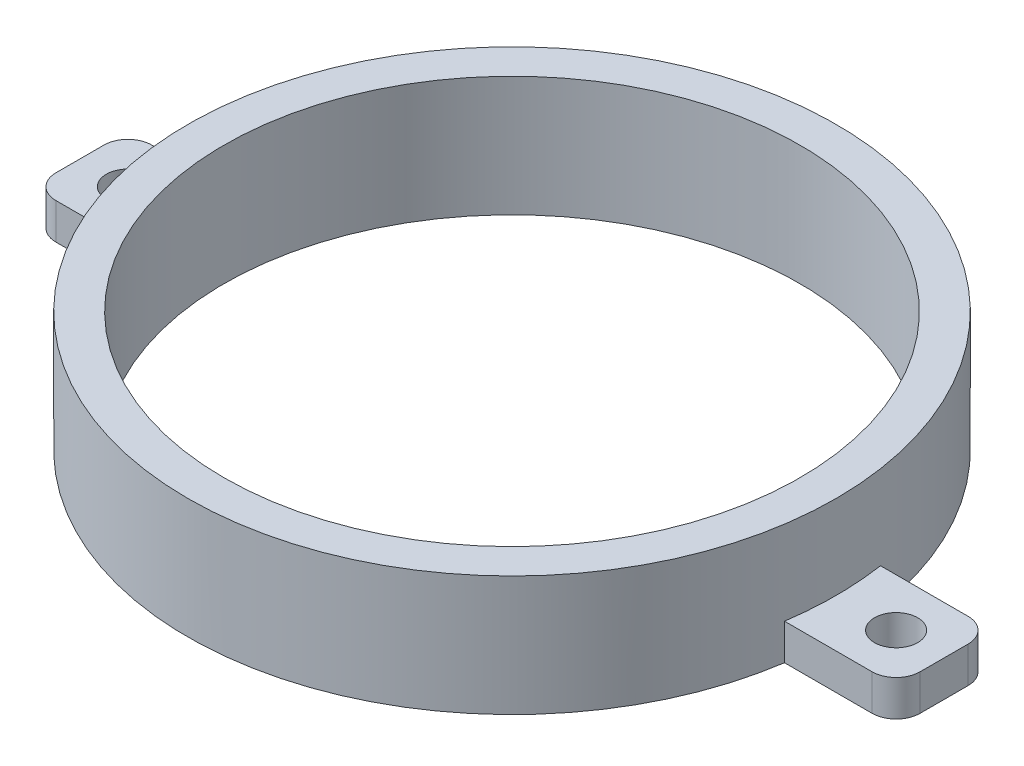
from build123d import *

# Parameters (mm, degrees)
SKETCH1_R           = 27
SKETCH1_R_2         = 24
BOSS_EXTRUDE1_DEPTH = 10
SKETCH3_R           = 1.8
BOSS_EXTRUDE2_DEPTH = 3


with BuildPart() as part:
    # Sketch1 → Boss-Extrude1 (new body)
    with BuildSketch(Plane(origin=(0, 0, 0), x_dir=(1, 0, 0), z_dir=(0, 1, 0))):
        with Locations(Location((0, 0, 0), (0, 0, 270))):
            Circle(SKETCH1_R)
        with Locations(Location((0, 0, 0), (0, 0, 270))):
            Circle(SKETCH1_R_2, mode=Mode.SUBTRACT)
    extrude(amount=BOSS_EXTRUDE1_DEPTH)

    # Sketch3 → Boss-Extrude2 (add)
    with BuildSketch(Plane(origin=(0, 0, 0), x_dir=(1, 0, 0), z_dir=(0, 1, 0))):
        with BuildLine():
            Line((-24, 0), (-24, 4))
            Line((-24, 4), (-34, 4))
            ThreePointArc((-34, 4), (-35.414213562, 3.414213562), (-36, 2))
            Line((-36, 2), (-36, -2))
            ThreePointArc((-36, -2), (-35.414213562, -3.414213562), (-34, -4))
            Line((-34, -4), (-24, -4))
            Line((-24, -4), (-24, 0))
        make_face()
        with Locations(Location((-32, 0, 0), (0, 0, 270))):
            Circle(SKETCH3_R, mode=Mode.SUBTRACT)
    boss_extrude2 = extrude(amount=BOSS_EXTRUDE2_DEPTH)

    # Mirror1: Boss-Extrude2 across plane
    add(boss_extrude2.mirror(Plane(origin=(0, 0, 0), x_dir=(0, 0, 1), z_dir=(1, 0, 0))))


solid = part.part
